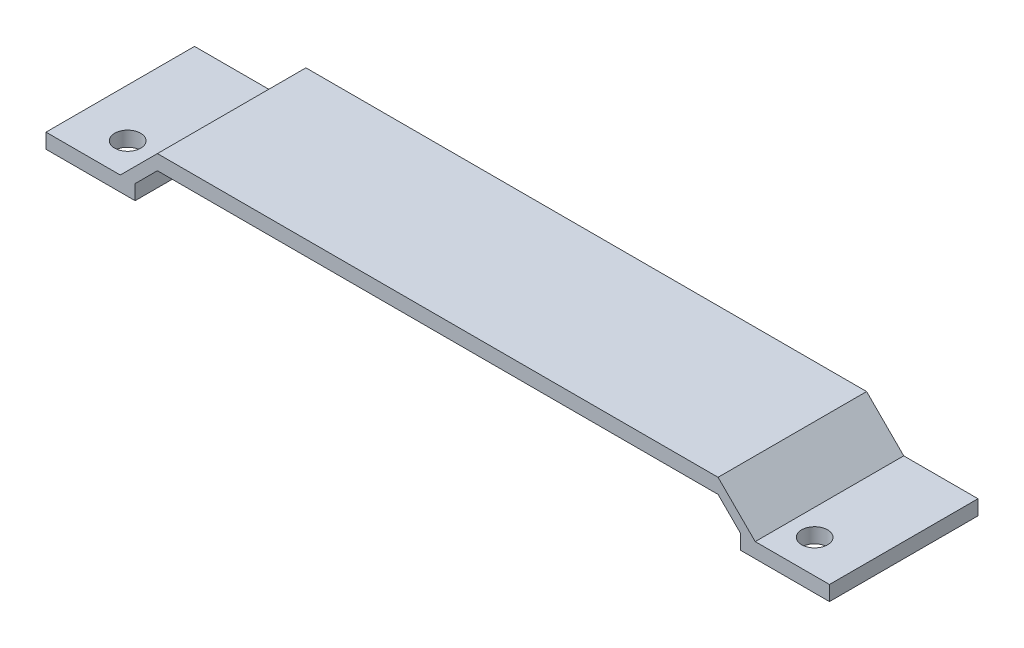
from build123d import *

# Parameters (mm, degrees)
ESQUISSE4_W             = 12
ESQUISSE4_H             = 2
ESQUISSE4_W_2           = 37.75
BOSS_EXTRU_2_DEPTH      = 20
ESQUISSE5_R             = 1.75
ENL_V_MAT_EXTRU_1_DEPTH = 57.846833685


with BuildPart() as part:
    # Esquisse4 → Boss.-Extru.2 (new body)
    with BuildSketch(Plane.XY):
        with Locations((-46.75, -4)):
            Rectangle(ESQUISSE4_W, ESQUISSE4_H)
        Polygon((-40.75, -3), (-37.75, 0), (-37.75, 2), (-42.75, -3), align=None)
        with Locations((-18.875, 1)):
            Rectangle(ESQUISSE4_W_2, ESQUISSE4_H)
        with Locations((18.875, 1)):
            Rectangle(ESQUISSE4_W_2, ESQUISSE4_H)
        Polygon((37.75, 2), (37.75, 0), (40.75, -3), (42.75, -3), align=None)
        with Locations((46.75, -4)):
            Rectangle(ESQUISSE4_W, ESQUISSE4_H)
    extrude(amount=BOSS_EXTRU_2_DEPTH)

    # Esquisse5 → Enlèv. mat.-Extru.1 (cut, through all)
    with BuildSketch(Plane(origin=(0, 2, 0), x_dir=(1, 0, 0), z_dir=(0, 1, 0))):
        with Locations(Location((-46.25, -15.5, 0), (0, 0, 270))):
            Circle(ESQUISSE5_R)
        with Locations(Location((46.25, -15.5, 0), (0, 0, 270))):
            Circle(ESQUISSE5_R)
    extrude(amount=-ENL_V_MAT_EXTRU_1_DEPTH, mode=Mode.SUBTRACT)


solid = part.part
